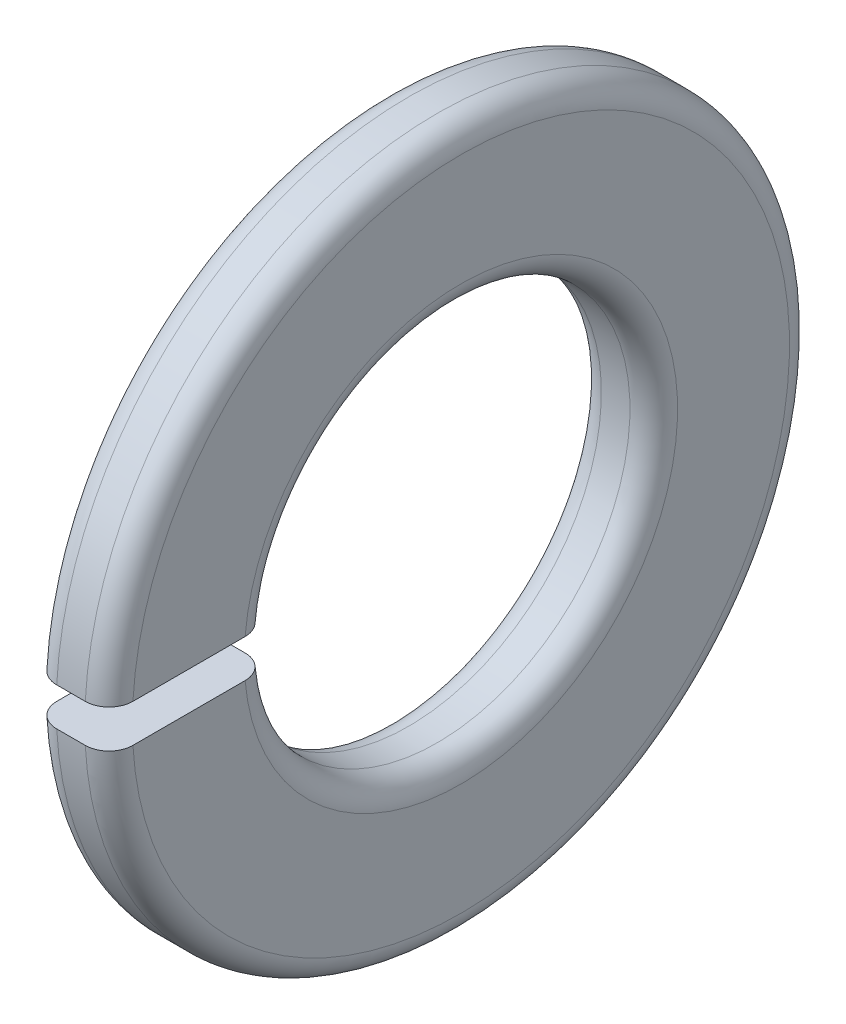
from build123d import *

# Parameters (mm, degrees)
SKETCH2_W = 0.8
SKETCH2_H = 7.548
GAP_DEPTH = 11.586784214
CONG_1_R  = 0.5


with BuildPart() as part:
    # Sketch1 → Base-Revolve (revolve)
    with BuildSketch(Plane.XY, mode=Mode.PRIVATE) as base_revolve_sk:
        with BuildLine():
            Line((0, 4.55), (0, 7.4))
            Line((0, 7.4), (-1.6, 7.4))
            Line((-1.6, 7.4), (-1.6, 4.55))
            ThreePointArc((-1.6, 4.55), (-1.453553391, 4.196446609), (-1.1, 4.05))
            Line((-1.1, 4.05), (-0.5, 4.05))
            ThreePointArc((-0.5, 4.05), (-0.146446609, 4.196446609), (0, 4.55))
        make_face()
    revolve(base_revolve_sk.sketch.rotate(Axis((-34.925, 0, 0), (1, 0, 0)), 90), axis=Axis((-34.925, 0, 0), (1, 0, 0)))

    # Sketch2 → Gap (cut, through all)
    with BuildSketch(Plane(origin=(0, 0, 0), x_dir=(0, -1, 0), z_dir=(-1, 0, 0))):
        with Locations((0, 3.774)):
            Rectangle(SKETCH2_W, SKETCH2_H)
    extrude(amount=GAP_DEPTH, mode=Mode.SUBTRACT)

    # Congé1
    cong_1_edges = [part.edges().sort_by_distance(p)[0] for p in [
        (-1.6, 0, -7.4),
        (0, 0, -7.4),
    ]]
    fillet(cong_1_edges, radius=CONG_1_R)


solid = part.part
